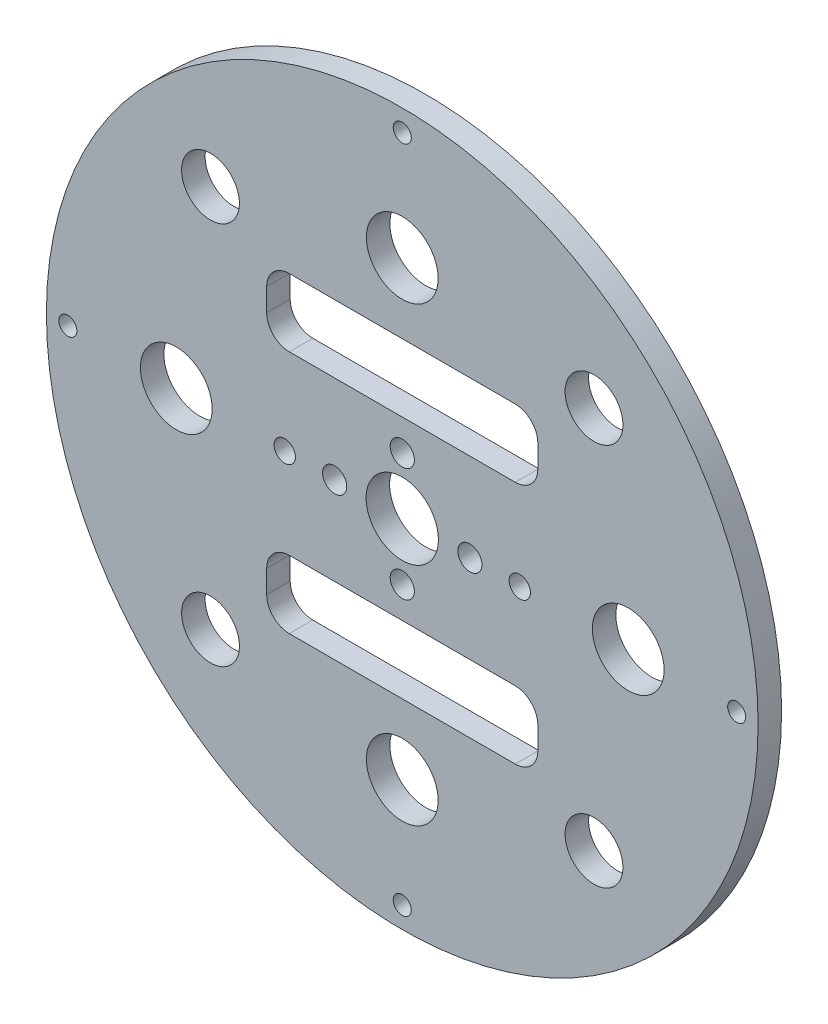
from build123d import *

# Parameters (mm, degrees)
SKETCH_1_R                    = 50
EXTRUDE_1_DEPTH               = 3.302
SKETCH_2_R                    = 4.064
CUT_EXTRUDE_1_DEPTH           = 71.787733429
SKETCH_4_R                    = 5.08
CUT_EXTRUDE_3_DEPTH           = 71.787733429
SKETCH_7_R                    = 1.27
CUT_EXTRUDE_6_DEPTH           = 71.787733429
M3_CLEARANCE_HOLE1_AT_2_COUNT = 2
M3_CLEARANCE_HOLE1_AT_2_PITCH = 12.419742348
F_3_8_CLEARANCE_HOLE1_D       = 10.0838
SKETCH11_R                    = 1.5
CUT_EXTRUDE5_DEPTH            = 71.787733429
CIRPATTERN1_COUNT             = 2
CIRPATTERN2_COUNT             = 2
SKETCH12_W                    = 38.1
SKETCH12_H                    = 9.525
CUT_EXTRUDE6_DEPTH            = 71.787733429
FILLET1_R                     = 3.175
FILLET1_OF_MIRROR1_R          = 3.175


with BuildPart() as part:
    # 草图1 → 凸台-拉伸1 (new body)
    with BuildSketch(Plane.XY):
        with Locations(Location((0, 0, 0), (0, 0, 180))):
            Circle(SKETCH_1_R)
    extrude(amount=EXTRUDE_1_DEPTH)

    # 草图2 → 切除-拉伸1 (cut, through all)
    with BuildSketch(Plane.XY.offset(3.302)):
        with Locations((-26.940768363, 26.940768363)):
            Circle(SKETCH_2_R)
        with Locations((-26.940768363, -26.940768363)):
            Circle(SKETCH_2_R)
        with Locations((26.940768363, -26.940768363)):
            Circle(SKETCH_2_R)
        with Locations((26.940768363, 26.940768363)):
            Circle(SKETCH_2_R)
    extrude(amount=-CUT_EXTRUDE_1_DEPTH, mode=Mode.SUBTRACT)

    # 草图4 → 切除-拉伸3 (cut, through all)
    with BuildSketch(Plane.XY.offset(3.302)):
        Circle(SKETCH_4_R)
    extrude(amount=-CUT_EXTRUDE_3_DEPTH, mode=Mode.SUBTRACT)

    # 草图7 → 切除-拉伸6 (cut, through all)
    with BuildSketch(Plane.XY.offset(3.302)):
        with Locations((0, 46.99)):
            Circle(SKETCH_7_R)
        with Locations((46.99, 0)):
            Circle(SKETCH_7_R)
        with Locations((0, -46.99)):
            Circle(SKETCH_7_R)
        with Locations((-46.99, 0)):
            Circle(SKETCH_7_R)
    extrude(amount=-CUT_EXTRUDE_6_DEPTH, mode=Mode.SUBTRACT)

    # Sketch2 → M3 Clearance Hole1 (revolve, cut)
    with BuildSketch(Plane(origin=(0, 8, 3.302), x_dir=(0, -1, 0), z_dir=(1, 0, 0))):
        Polygon((0, 0), (0, 26.421463052), (1.7, 25.4), (1.7, 0), align=None)
    m3_clearance_hole1 = revolve(axis=Axis((0, 8, 9.652), (0, 0, -1)), mode=Mode.SUBTRACT)

    # M3 Clearance Hole1 at 2: M3 Clearance Hole1 ×2
    with Locations(*[Vector(-0.7649111981170567, -0.6441357457827728, 0) * (i * M3_CLEARANCE_HOLE1_AT_2_PITCH) for i in range(1, M3_CLEARANCE_HOLE1_AT_2_COUNT)]):
        add(m3_clearance_hole1, mode=Mode.SUBTRACT)

    # 3/8 Clearance Hole1 (through all)
    with Locations(Plane.XY.offset(3.302)):
        with Locations((0, 31.75), (-31.75, 0), (31.75, 0), (0, -31.75)):
            Hole(F_3_8_CLEARANCE_HOLE1_D / 2)

    # Sketch11 → Cut-Extrude5 (cut, through all)
    with BuildSketch(Plane.XY.offset(3.302)):
        with Locations((-16.51, 0)):
            Circle(SKETCH11_R)
    cut_extrude5 = extrude(amount=-CUT_EXTRUDE5_DEPTH, mode=Mode.SUBTRACT)

    # CirPattern1: Cut-Extrude5 ×2 about axis
    cirpattern1_axis = Axis((0, 0, 0), (0, 0, 1))
    for i in range(1, CIRPATTERN1_COUNT):
        add(cut_extrude5.rotate(cirpattern1_axis, i * 360 / CIRPATTERN1_COUNT), mode=Mode.SUBTRACT)

    # CirPattern2: M3 Clearance Hole1 ×2 about axis
    cirpattern2_axis = Axis((0, 0, 0), (0, 0, 1))
    for i in range(1, CIRPATTERN2_COUNT):
        add(m3_clearance_hole1.rotate(cirpattern2_axis, i * 360 / CIRPATTERN2_COUNT), mode=Mode.SUBTRACT)

    # CirPattern2 copy 1 sketch → CirPattern2 copy 1 (revolve, cut)
    with BuildSketch(Plane(origin=(9.5, 0, 3.302), x_dir=(0, 1, 0), z_dir=(-1, 0, 0))):
        Polygon((0, 0), (0, 26.421463052), (1.7, 25.4), (1.7, 0), align=None)
    revolve(axis=Axis((9.5, 0, 9.652), (0, 0, -1)), mode=Mode.SUBTRACT)

    # Sketch12 → Cut-Extrude6 (cut, through all)
    with BuildSketch(Plane.XY.offset(3.302)):
        with Locations((0, 17.145)):
            Rectangle(SKETCH12_W, SKETCH12_H)
    cut_extrude6 = extrude(amount=-CUT_EXTRUDE6_DEPTH, mode=Mode.SUBTRACT)

    # Fillet1
    fillet1_edges = [part.edges().sort_by_distance(p)[0] for p in [
        (19.05, 21.9075, 1.651),
        (19.05, 12.3825, 1.651),
        (-19.05, 12.3825, 1.651),
        (-19.05, 21.9075, 1.651),
    ]]
    fillet(fillet1_edges, radius=FILLET1_R)

    # Mirror1: Cut-Extrude6 across plane
    add(cut_extrude6.mirror(Plane.ZX), mode=Mode.SUBTRACT)

    # Fillet1 of Mirror1
    fillet1_of_mirror1_edges = [part.edges().sort_by_distance(p)[0] for p in [
        (19.05, -21.9075, 1.651),
        (19.05, -12.3825, 1.651),
        (-19.05, -12.3825, 1.651),
        (-19.05, -21.9075, 1.651),
    ]]
    fillet(fillet1_of_mirror1_edges, radius=FILLET1_OF_MIRROR1_R)


solid = part.part
